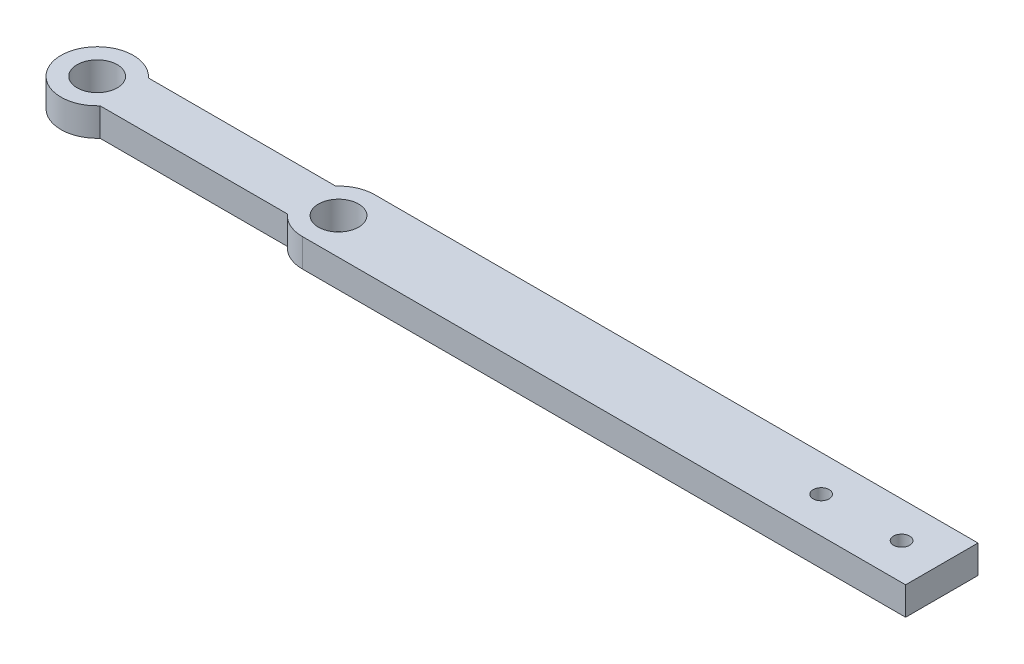
from build123d import *

# Parameters (mm, degrees)
BOSS_EXTRUDE1_DEPTH = 7
SKETCH2_R           = 5
CUT_EXTRUDE1_DEPTH  = 211.309296038
SKETCH3_R           = 2
CUT_EXTRUDE2_DEPTH  = 211.309296038


with BuildPart() as part:
    # Sketch1 → Boss-Extrude1 (new body)
    with BuildSketch(Plane(origin=(0, 0, 0), x_dir=(1, 0, 0), z_dir=(0, 1, 0))):
        with BuildLine():
            Line((6.708203932, 6), (53.291796068, 6))
            ThreePointArc((53.291796068, 6), (56.325765386, 8.215838363), (60, 9))
            Line((60, 9), (210, 9))
            Line((210, 9), (210, -9))
            Line((210, -9), (60, -9))
            ThreePointArc((60, -9), (56.325765386, -8.215838363), (53.291796068, -6))
            Line((53.291796068, -6), (6.708203932, -6))
            ThreePointArc((6.708203932, -6), (-9, 0), (6.708203932, 6))
        make_face()
    extrude(amount=BOSS_EXTRUDE1_DEPTH)

    # Sketch2 → Cut-Extrude1 (cut, through all)
    with BuildSketch(Plane(origin=(0, 7, 0), x_dir=(1, 0, 0), z_dir=(0, 1, 0))):
        with Locations(Location((0, 0, 0), (0, 0, 270))):
            Circle(SKETCH2_R)
        with Locations(Location((60, 0, 0), (0, 0, 270))):
            Circle(SKETCH2_R)
    extrude(amount=-CUT_EXTRUDE1_DEPTH, mode=Mode.SUBTRACT)

    # Sketch3 → Cut-Extrude2 (cut, through all)
    with BuildSketch(Plane(origin=(0, 7, 0), x_dir=(1, 0, 0), z_dir=(0, 1, 0))):
        with Locations(Location((200, 0, 0), (0, 0, 270))):
            Circle(SKETCH3_R)
        with Locations(Location((180, 0, 0), (0, 0, 270))):
            Circle(SKETCH3_R)
    extrude(amount=-CUT_EXTRUDE2_DEPTH, mode=Mode.SUBTRACT)


solid = part.part
